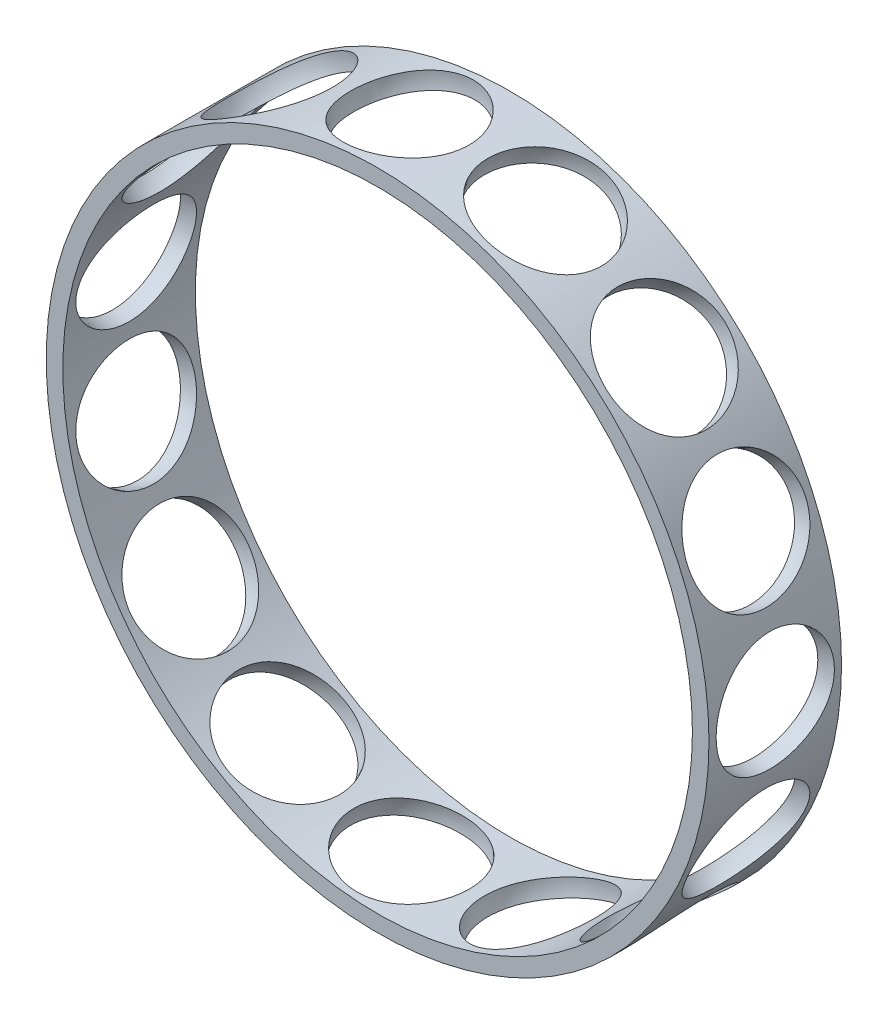
from build123d import *

# Parameters (mm, degrees)
SKETCH_1_R               = 50
SKETCH_1_R_2             = 47.5
EXTRUDE_1_DEPTH          = 10
PATTERN_CIRCULAR_1_COUNT = 15


with BuildPart() as part:
    # 草图1 → 凸台-拉伸1 (new, symmetric)
    with BuildSketch(Plane.XY):
        Circle(SKETCH_1_R)
        Circle(SKETCH_1_R_2, mode=Mode.SUBTRACT)
    extrude(amount=EXTRUDE_1_DEPTH, both=True)

    # 草图2 → 切除-旋转1 (revolve, cut)
    with BuildSketch(Plane(origin=(0, 0, 0), x_dir=(1, 0, 0), z_dir=(0, 1, 0))):
        with BuildLine():
            Line((48.75, 9), (48.75, -9))
            ThreePointArc((48.75, -9), (57.75, 0), (48.75, 9))
        make_face()
    cut_revolve_1 = revolve(axis=Axis((48.75, 0, -9), (0, 0, 1)), mode=Mode.SUBTRACT)

    # 阵列(圆周)1: 切除-旋转1 ×15 about axis
    pattern_circular_1_axis = Axis((0, 0, 0), (0, 0, 1))
    for i in range(1, PATTERN_CIRCULAR_1_COUNT):
        add(cut_revolve_1.rotate(pattern_circular_1_axis, i * 360 / PATTERN_CIRCULAR_1_COUNT), mode=Mode.SUBTRACT)


solid = part.part
